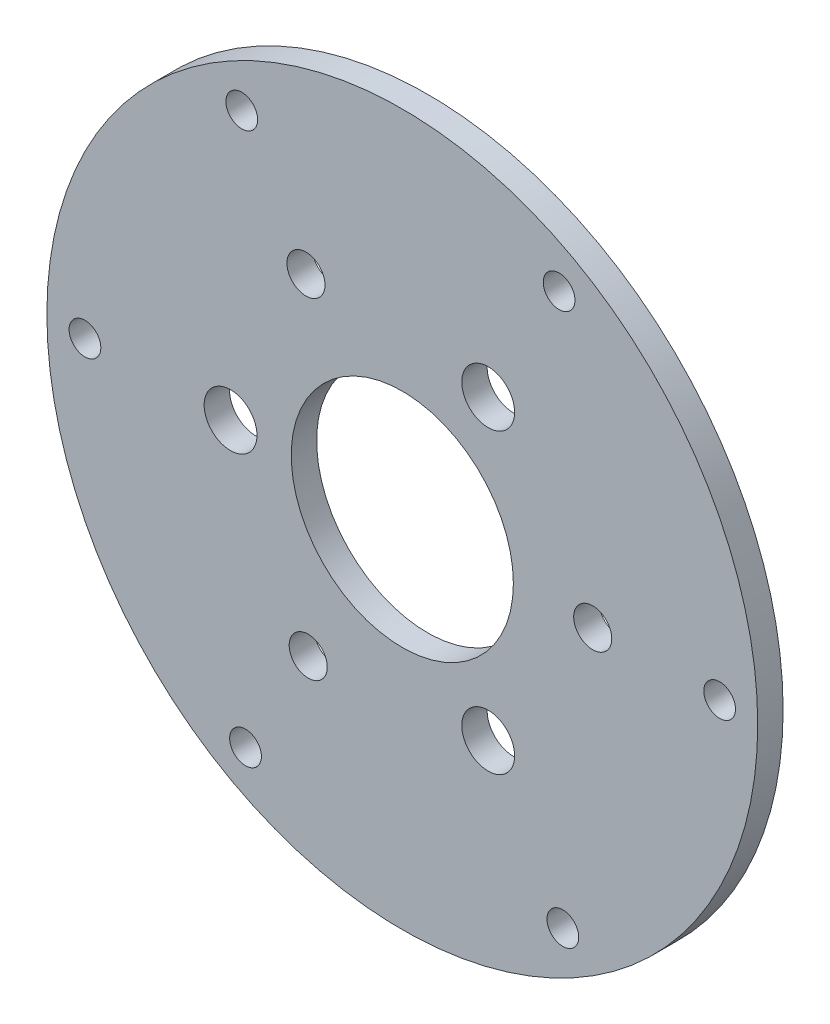
from build123d import *

# Parameters (mm, degrees)
SKETCH_1_R      = 28
SKETCH_1_R_2    = 2.08
SKETCH_1_R_3    = 8.75
SKETCH_1_R_4    = 1.25
SKETCH_1_R_5    = 1.5
EXTRUDE_1_DEPTH = 2


with BuildPart() as part:
    # 草图1 → 凸台-拉伸1 (new body)
    with BuildSketch(Plane.XY):
        Circle(SKETCH_1_R)
        with Locations((-13.53, 0)):
            Circle(SKETCH_1_R_2, mode=Mode.SUBTRACT)
        with Locations((6.765, 11.717323713)):
            Circle(SKETCH_1_R_2, mode=Mode.SUBTRACT)
        with Locations((6.765, -11.717323713)):
            Circle(SKETCH_1_R_2, mode=Mode.SUBTRACT)
        Circle(SKETCH_1_R_3, mode=Mode.SUBTRACT)
        with Locations((12.351862398, 21.735489304)):
            Circle(SKETCH_1_R_4, mode=Mode.SUBTRACT)
        with Locations((24.9994171, 0.170718032)):
            Circle(SKETCH_1_R_4, mode=Mode.SUBTRACT)
        with Locations((12.647554702, -21.564771273)):
            Circle(SKETCH_1_R_4, mode=Mode.SUBTRACT)
        with Locations((-12.351862398, -21.735489304)):
            Circle(SKETCH_1_R_4, mode=Mode.SUBTRACT)
        with Locations((-24.9994171, -0.170718032)):
            Circle(SKETCH_1_R_4, mode=Mode.SUBTRACT)
        with Locations((-12.647554702, 21.564771273)):
            Circle(SKETCH_1_R_4, mode=Mode.SUBTRACT)
        with Locations((-7.411117439, -13.041293583)):
            Circle(SKETCH_1_R_5, mode=Mode.SUBTRACT)
        with Locations((-7.588532821, 12.938862764)):
            Circle(SKETCH_1_R_5, mode=Mode.SUBTRACT)
        with Locations((14.99965026, 0.102430819)):
            Circle(SKETCH_1_R_5, mode=Mode.SUBTRACT)
    extrude(amount=EXTRUDE_1_DEPTH)


solid = part.part
